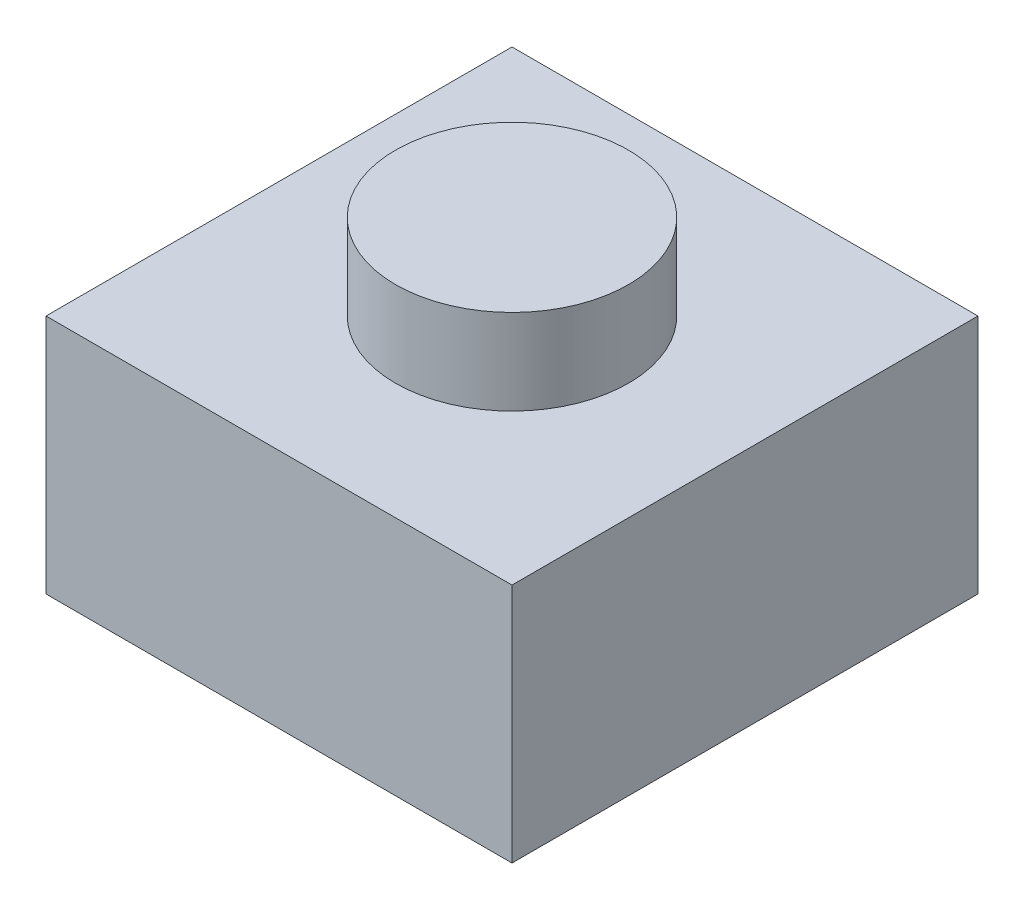
from build123d import *

# Parameters (mm, degrees)
SKETCH_1_W      = 6
SKETCH_1_H      = 6
EXTRUDE_1_DEPTH = 3.1
SKETCH_2_R      = 1.5
EXTRUDE_2_DEPTH = 1.1


with BuildPart() as part:
    # 草图1 → 拉伸1 (new body)
    with BuildSketch(Plane(origin=(0, 0, 0), x_dir=(1, 0, 0), z_dir=(0, 1, 0))):
        Rectangle(SKETCH_1_W, SKETCH_1_H)
    extrude(amount=EXTRUDE_1_DEPTH)

    # 草图2 → 拉伸2 (add)
    with BuildSketch(Plane(origin=(0, 3.1, 0), x_dir=(-1, 0, 0), z_dir=(0, 1, 0))):
        with Locations(Location((0, 0, 0), (0, 0, 90))):
            Circle(SKETCH_2_R)
    extrude(amount=EXTRUDE_2_DEPTH)


solid = part.part
